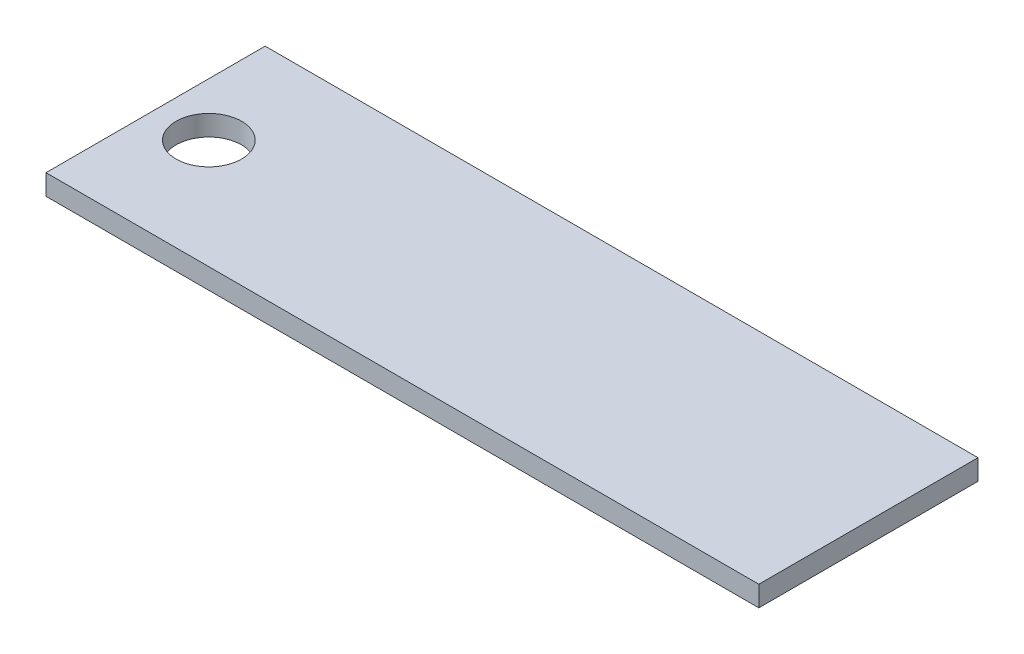
from build123d import *

# Parameters (mm, degrees)
SKETCH1_W           = 34.8
SKETCH1_H           = 10.7
SKETCH1_R           = 1.6
BOSS_EXTRUDE1_DEPTH = 1


with BuildPart() as part:
    # Sketch1 → Boss-Extrude1 (new body)
    with BuildSketch(Plane(origin=(0, 0, 0), x_dir=(1, 0, 0), z_dir=(0, 1, 0))):
        with Locations((17.4, 5.35)):
            Rectangle(SKETCH1_W, SKETCH1_H)
        with Locations(Location((2.6, 5.35, 0), (0, 0, 270))):
            Circle(SKETCH1_R, mode=Mode.SUBTRACT)
    extrude(amount=BOSS_EXTRUDE1_DEPTH)


solid = part.part
